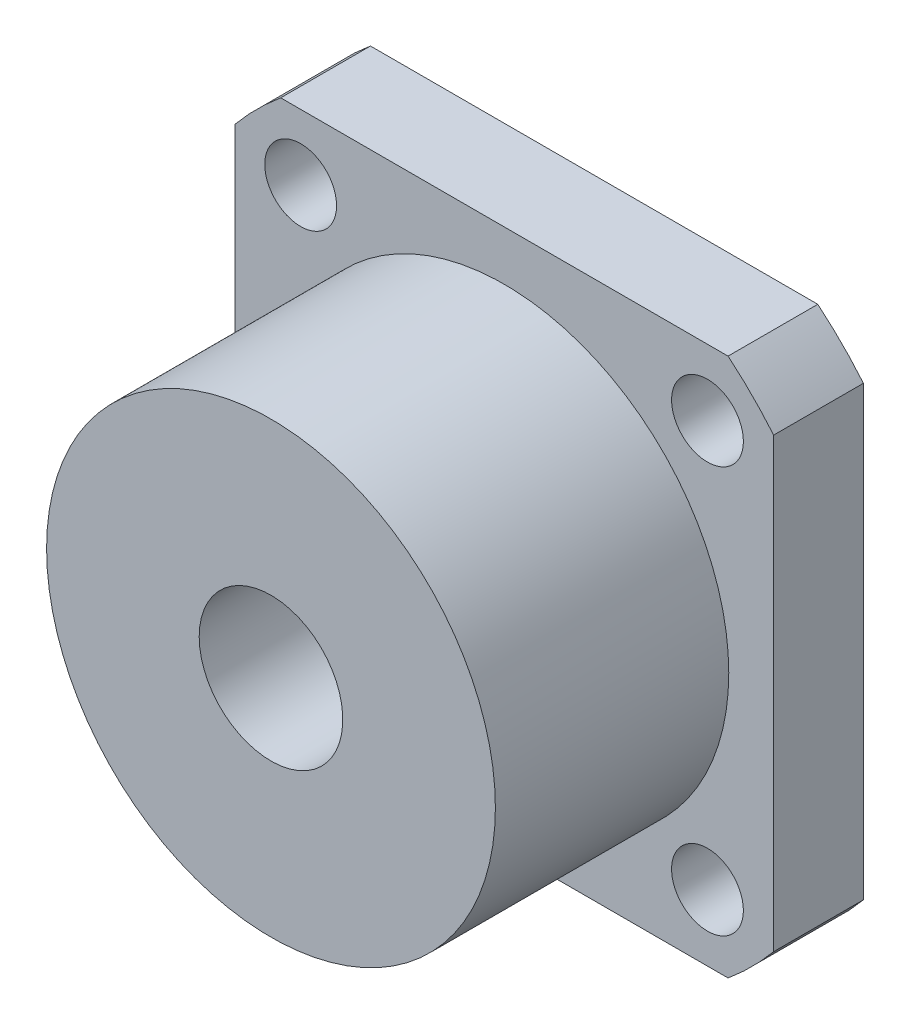
from build123d import *

# Parameters (mm, degrees)
SKETCH_1_R          = 2
EXTRUDE_1_DEPTH     = 5
SKETCH_3_R          = 12.5
SKETCH_3_R_2        = 4
EXTRUDE_2_DEPTH     = 13
SKETCH_5_R          = 4
CUT_EXTRUDE_1_DEPTH = 26.039562279


with BuildPart() as part:
    # 草图1 → 凸台-拉伸1 (new body)
    with BuildSketch(Plane.XY):
        with BuildLine():
            Line((-12.459935794, -14.736328125), (12.459935794, -14.736328125))
            ThreePointArc((12.459935794, -14.736328125), (13.788582233, -13.524910358), (15, -12.196263919))
            Line((15, -12.196263919), (15, 12.723607669))
            ThreePointArc((15, 12.723607669), (13.788582233, 14.052254108), (12.459935794, 15.263671875))
            Line((12.459935794, 15.263671875), (-12.459935794, 15.263671875))
            ThreePointArc((-12.459935794, 15.263671875), (-13.788582233, 14.052254108), (-15, 12.723607669))
            Line((-15, 12.723607669), (-15, -12.196263919))
            ThreePointArc((-15, -12.196263919), (-13.788582233, -13.524910358), (-12.459935794, -14.736328125))
        make_face()
        with Locations((-11.347647071, 11.611318946)):
            Circle(SKETCH_1_R, mode=Mode.SUBTRACT)
        with Locations((11.313708499, 11.577380374)):
            Circle(SKETCH_1_R, mode=Mode.SUBTRACT)
        with Locations((11.313708499, -11.050036624)):
            Circle(SKETCH_1_R, mode=Mode.SUBTRACT)
        with Locations((-11.313708499, -11.050036624)):
            Circle(SKETCH_1_R, mode=Mode.SUBTRACT)
    extrude(amount=EXTRUDE_1_DEPTH)

    # 草图3 → 凸台-拉伸2 (add)
    with BuildSketch(Plane.XY.offset(5)):
        with Locations(Location((0, 0, 0), (0, 0, 180))):
            Circle(SKETCH_3_R)
        with Locations(Location((0, 0, 0), (0, 0, 180))):
            Circle(SKETCH_3_R_2, mode=Mode.SUBTRACT)
    extrude(amount=EXTRUDE_2_DEPTH)

    # 草图5 → 切除-拉伸1 (cut, through all)
    with BuildSketch(Plane.XY.offset(5)):
        with Locations(Location((0, 0, 0), (0, 0, 180))):
            Circle(SKETCH_5_R)
    extrude(amount=-CUT_EXTRUDE_1_DEPTH, mode=Mode.SUBTRACT)


solid = part.part
